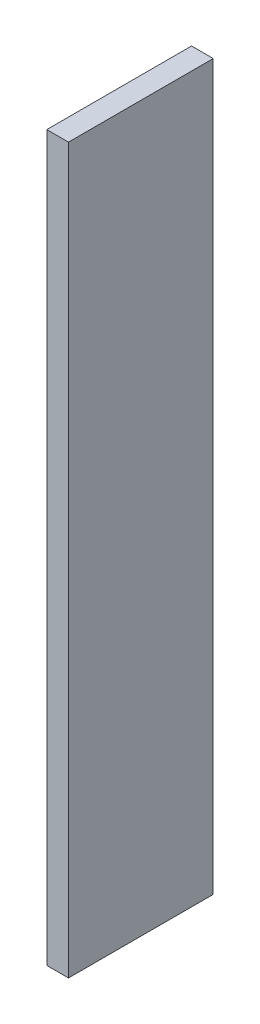
from build123d import *

# Parameters (mm, degrees)
SKETCH_3_W             = 30
SKETCH_3_H             = 1000
EXTRUDE_1_DEPTH        = 100
SKETCH_6_R             = 50
EXTRUDE_2_DEPTH        = 20
PATTERN_LINEAR_1_COUNT = 4
PATTERN_LINEAR_1_PITCH = 250


with BuildPart() as part:
    # 草图3 → 凸台-拉伸1 (new, symmetric)
    with BuildSketch(Plane.XY):
        Rectangle(SKETCH_3_W, SKETCH_3_H)
    extrude(amount=EXTRUDE_1_DEPTH, both=True)

    # 草图6 → 凸台-拉伸2 (add)
    with BuildSketch(Plane.ZY.offset(15)):
        with Locations(Location((0, 375, 0), (0, 0, 90))):
            Circle(SKETCH_6_R)
    extrude_2 = extrude(amount=EXTRUDE_2_DEPTH)

    # 阵列(线性)1: 凸台-拉伸2 ×4
    with Locations(*[(0, -i * PATTERN_LINEAR_1_PITCH, 0) for i in range(1, PATTERN_LINEAR_1_COUNT)]):
        add(extrude_2)


solid = part.part
